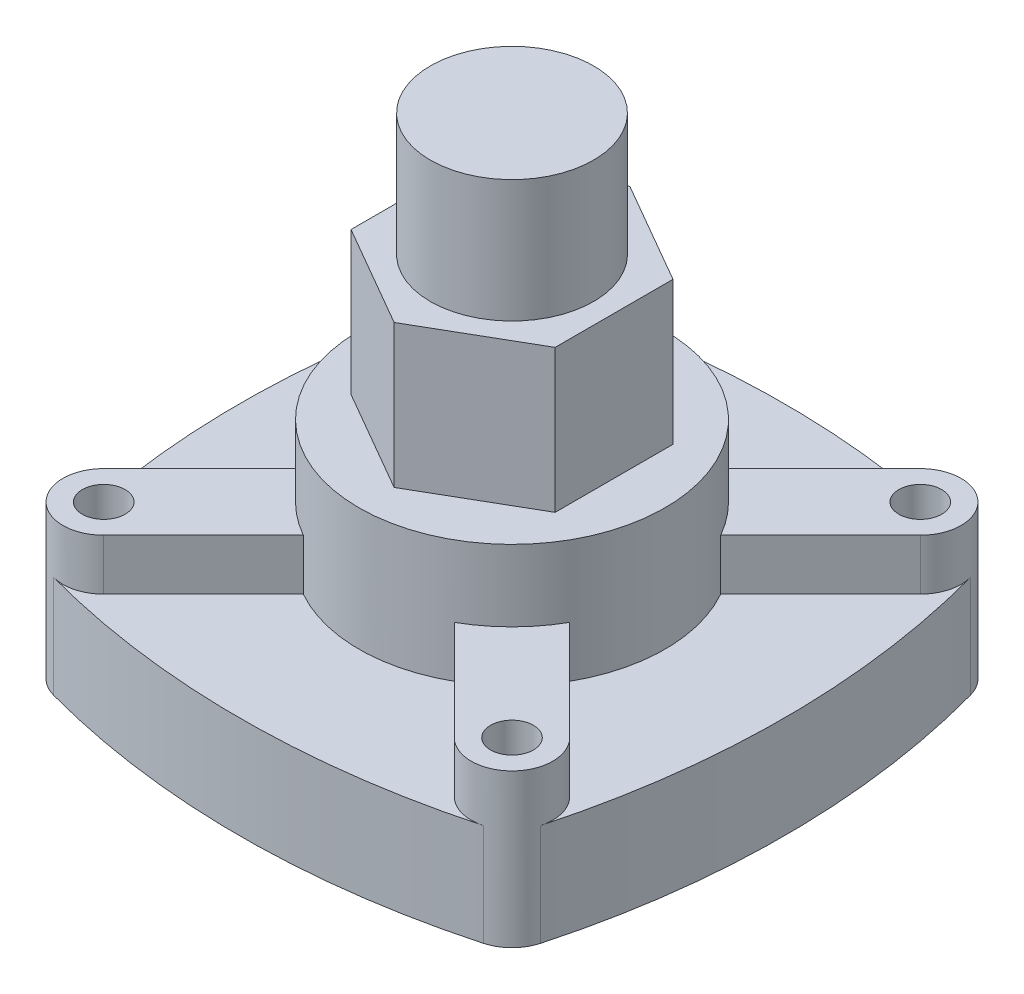
from build123d import *

# Parameters (mm, degrees)
SKETCH3_R             = 4
BOSS_EXTRUDE2_DEPTH   = 10
SKETCH4_R             = 15
BOSS_EXTRUDE3_DEPTH   = 12
SHELL2_T              = -1
BOSS_EXTRUDE4_DEPTH   = 14
SKETCH6_R             = 8
BOSS_EXTRUDE5_DEPTH   = 12
BOSS_EXTRUDE6_DEPTH   = 5
M5X0_8_TAPPED_HOLE1_D = 4.2


with BuildPart() as part:
    # Sketch3 → Boss-Extrude2 (new body)
    with BuildSketch(Plane(origin=(0, 0, 0), x_dir=(1, 0, 0), z_dir=(0, 1, 0))):
        with Locations((-20, -20)):
            Circle(SKETCH3_R)
        with BuildLine():
            ThreePointArc((23.859011112, 21.052631579), (23.964596098, 20.531015797), (24, 20))
            ThreePointArc((24, 20), (16.821122343, 17.572092085), (21.052631579, 23.859011112))
            ThreePointArc((21.052631579, 23.859011112), (0, 26.678788881), (-21.052631579, 23.859011112))
            ThreePointArc((-21.052631579, 23.859011112), (-17.572092085, 23.178877657), (-16, 20))
            ThreePointArc((-16, 20), (-20.531015797, 16.035403902), (-23.859011112, 21.052631579))
            ThreePointArc((-23.859011112, 21.052631579), (-26.678788881, 0), (-23.859011112, -21.052631579))
            ThreePointArc((-23.859011112, -21.052631579), (-20.531015797, -16.035403902), (-16, -20))
            ThreePointArc((-16, -20), (-17.572092085, -23.178877657), (-21.052631579, -23.859011112))
            ThreePointArc((-21.052631579, -23.859011112), (0, -26.678788881), (21.052631579, -23.859011112))
            ThreePointArc((21.052631579, -23.859011112), (16.821122343, -17.572092085), (24, -20))
            ThreePointArc((24, -20), (23.964596098, -20.531015797), (23.859011112, -21.052631579))
            ThreePointArc((23.859011112, -21.052631579), (26.678788881, 0), (23.859011112, 21.052631579))
        make_face()
        with Locations((-20, 20)):
            Circle(SKETCH3_R)
        with Locations((20, -20)):
            Circle(SKETCH3_R)
        with Locations((20, 20)):
            Circle(SKETCH3_R)
    extrude(amount=BOSS_EXTRUDE2_DEPTH)

    # Sketch4 → Boss-Extrude3 (add)
    with BuildSketch(Plane(origin=(0, 10, 0), x_dir=(1, 0, 0), z_dir=(0, 1, 0))):
        with Locations(Location((0, 0, 0), (0, 0, 270))):
            Circle(SKETCH4_R)
    extrude(amount=BOSS_EXTRUDE3_DEPTH)

    # Shell2
    shell2_openings = [part.faces().sort_by_distance(p)[0] for p in [
        (0, 0, 0),
    ]]
    offset(amount=SHELL2_T, openings=shell2_openings, kind=Kind.INTERSECTION)

    # Sketch5 → Boss-Extrude4 (add)
    with BuildSketch(Plane(origin=(0, 22, 0), x_dir=(1, 0, 0), z_dir=(0, 1, 0))):
        Polygon((0, 11.547005384), (-10, 5.773502692), (-10, -5.773502692), (0, -11.547005384), (10, -5.773502692), (10, 5.773502692), align=None)
    extrude(amount=BOSS_EXTRUDE4_DEPTH)

    # Sketch6 → Boss-Extrude5 (add)
    with BuildSketch(Plane(origin=(0, 36, 0), x_dir=(1, 0, 0), z_dir=(0, 1, 0))):
        with Locations(Location((0, 0, 0), (0, 0, 270))):
            Circle(SKETCH6_R)
    extrude(amount=BOSS_EXTRUDE5_DEPTH)

    # Sketch7 → Boss-Extrude6 (add)
    with BuildSketch(Plane(origin=(0, 10, 0), x_dir=(1, 0, 0), z_dir=(0, 1, 0))):
        with BuildLine():
            ThreePointArc((23.859011112, 21.052631579), (22.828427125, 22.828427125), (21.052631579, 23.859011112))
            ThreePointArc((21.052631579, 23.859011112), (18.973409384, 23.866020138), (17.171572875, 22.828427125))
            ThreePointArc((17.171572875, 22.828427125), (16.30448187, 21.530733729), (16, 20))
            Line((16, 20), (20, 20))
            Line((20, 20), (20, 16))
            ThreePointArc((20, 16), (21.530733729, 16.30448187), (22.828427125, 17.171572875))
            ThreePointArc((22.828427125, 17.171572875), (23.69551813, 18.469266271), (24, 20))
            ThreePointArc((24, 20), (23.964596098, 20.531015797), (23.859011112, 21.052631579))
        make_face()
        with BuildLine():
            Line((20, 20), (16, 20))
            ThreePointArc((16, 20), (16.30448187, 18.469266271), (17.171572875, 17.171572875))
            Line((17.171572875, 17.171572875), (20, 20))
        make_face()
        with BuildLine():
            Line((20, 16), (20, 20))
            Line((20, 20), (17.171572875, 17.171572875))
            ThreePointArc((17.171572875, 17.171572875), (18.469266271, 16.30448187), (20, 16))
        make_face()
        with BuildLine():
            Line((17.171572875, 17.171572875), (10.606601718, 10.606601718))
            ThreePointArc((10.606601718, 10.606601718), (11.937336386, 9.082951062), (13.050951275, 7.394097025))
            Line((13.050951275, 7.394097025), (20, 14.343145751))
            Line((20, 14.343145751), (20, 16))
            ThreePointArc((20, 16), (18.469266271, 16.30448187), (17.171572875, 17.171572875))
        make_face()
        with BuildLine():
            Line((16, 20), (14.343145751, 20))
            Line((14.343145751, 20), (7.394097025, 13.050951275))
            ThreePointArc((7.394097025, 13.050951275), (9.082951062, 11.937336386), (10.606601718, 10.606601718))
            Line((10.606601718, 10.606601718), (17.171572875, 17.171572875))
            ThreePointArc((17.171572875, 17.171572875), (16.30448187, 18.469266271), (16, 20))
        make_face()
        with BuildLine():
            ThreePointArc((-7.394097025, -13.050951275), (-9.082951062, -11.937336386), (-10.606601718, -10.606601718))
            Line((-10.606601718, -10.606601718), (-17.171572875, -17.171572875))
            ThreePointArc((-17.171572875, -17.171572875), (-16.30448187, -18.469266271), (-16, -20))
            Line((-16, -20), (-14.343145751, -20))
            Line((-14.343145751, -20), (-7.394097025, -13.050951275))
        make_face()
        with BuildLine():
            Line((-17.171572875, -17.171572875), (-10.606601718, -10.606601718))
            ThreePointArc((-10.606601718, -10.606601718), (-11.937336386, -9.082951062), (-13.050951275, -7.394097025))
            Line((-13.050951275, -7.394097025), (-20, -14.343145751))
            Line((-20, -14.343145751), (-20, -16))
            ThreePointArc((-20, -16), (-18.469266271, -16.30448187), (-17.171572875, -17.171572875))
        make_face()
        with BuildLine():
            ThreePointArc((-16, -20), (-16.30448187, -18.469266271), (-17.171572875, -17.171572875))
            Line((-17.171572875, -17.171572875), (-20, -20))
            Line((-20, -20), (-16, -20))
        make_face()
        with BuildLine():
            Line((-20, -20), (-17.171572875, -17.171572875))
            ThreePointArc((-17.171572875, -17.171572875), (-18.469266271, -16.30448187), (-20, -16))
            Line((-20, -16), (-20, -20))
        make_face()
        with BuildLine():
            ThreePointArc((-22.828427125, -17.171572875), (-23.866020138, -18.973409384), (-23.859011112, -21.052631579))
            ThreePointArc((-23.859011112, -21.052631579), (-22.828427125, -22.828427125), (-21.052631579, -23.859011112))
            ThreePointArc((-21.052631579, -23.859011112), (-18.973409384, -23.866020138), (-17.171572875, -22.828427125))
            ThreePointArc((-17.171572875, -22.828427125), (-16.30448187, -21.530733729), (-16, -20))
            Line((-16, -20), (-20, -20))
            Line((-20, -20), (-20, -16))
            ThreePointArc((-20, -16), (-21.530733729, -16.30448187), (-22.828427125, -17.171572875))
        make_face()
        with BuildLine():
            ThreePointArc((21.052631579, -23.859011112), (22.828427125, -22.828427125), (23.859011112, -21.052631579))
            ThreePointArc((23.859011112, -21.052631579), (23.964596098, -20.531015797), (24, -20))
            ThreePointArc((24, -20), (23.69551813, -18.469266271), (22.828427125, -17.171572875))
            ThreePointArc((22.828427125, -17.171572875), (21.530733729, -16.30448187), (20, -16))
            Line((20, -16), (20, -20))
            Line((20, -20), (16, -20))
            ThreePointArc((16, -20), (16.30448187, -21.530733729), (17.171572875, -22.828427125))
            ThreePointArc((17.171572875, -22.828427125), (18.973409384, -23.866020138), (21.052631579, -23.859011112))
        make_face()
        with BuildLine():
            Line((20, -20), (17.171572875, -17.171572875))
            ThreePointArc((17.171572875, -17.171572875), (16.30448187, -18.469266271), (16, -20))
            Line((16, -20), (20, -20))
        make_face()
        with BuildLine():
            ThreePointArc((20, -16), (18.469266271, -16.30448187), (17.171572875, -17.171572875))
            Line((17.171572875, -17.171572875), (20, -20))
            Line((20, -20), (20, -16))
        make_face()
        with BuildLine():
            ThreePointArc((13.050951275, -7.394097025), (11.937336386, -9.082951062), (10.606601718, -10.606601718))
            Line((10.606601718, -10.606601718), (17.171572875, -17.171572875))
            ThreePointArc((17.171572875, -17.171572875), (18.469266271, -16.30448187), (20, -16))
            Line((20, -16), (20, -14.343145751))
            Line((20, -14.343145751), (13.050951275, -7.394097025))
        make_face()
        with BuildLine():
            Line((17.171572875, -17.171572875), (10.606601718, -10.606601718))
            ThreePointArc((10.606601718, -10.606601718), (9.082951062, -11.937336386), (7.394097025, -13.050951275))
            Line((7.394097025, -13.050951275), (14.343145751, -20))
            Line((14.343145751, -20), (16, -20))
            ThreePointArc((16, -20), (16.30448187, -18.469266271), (17.171572875, -17.171572875))
        make_face()
        with BuildLine():
            Line((17.171572875, 22.828427125), (14.343145751, 20))
            Line((14.343145751, 20), (16, 20))
            ThreePointArc((16, 20), (16.30448187, 21.530733729), (17.171572875, 22.828427125))
        make_face()
        with BuildLine():
            ThreePointArc((22.828427125, 17.171572875), (21.530733729, 16.30448187), (20, 16))
            Line((20, 16), (20, 14.343145751))
            Line((20, 14.343145751), (22.828427125, 17.171572875))
        make_face()
        with BuildLine():
            ThreePointArc((-16, 20), (-16.30448187, 21.530733729), (-17.171572875, 22.828427125))
            ThreePointArc((-17.171572875, 22.828427125), (-18.973409384, 23.866020138), (-21.052631579, 23.859011112))
            ThreePointArc((-21.052631579, 23.859011112), (-22.828427125, 22.828427125), (-23.859011112, 21.052631579))
            ThreePointArc((-23.859011112, 21.052631579), (-23.866020138, 18.973409384), (-22.828427125, 17.171572875))
            ThreePointArc((-22.828427125, 17.171572875), (-21.530733729, 16.30448187), (-20, 16))
            Line((-20, 16), (-20, 20))
            Line((-20, 20), (-16, 20))
        make_face()
        with BuildLine():
            Line((-20, 14.343145751), (-20, 16))
            ThreePointArc((-20, 16), (-21.530733729, 16.30448187), (-22.828427125, 17.171572875))
            Line((-22.828427125, 17.171572875), (-20, 14.343145751))
        make_face()
        with BuildLine():
            Line((-17.171572875, 17.171572875), (-20, 20))
            Line((-20, 20), (-20, 16))
            ThreePointArc((-20, 16), (-18.469266271, 16.30448187), (-17.171572875, 17.171572875))
        make_face()
        with BuildLine():
            ThreePointArc((-17.171572875, 17.171572875), (-16.30448187, 18.469266271), (-16, 20))
            Line((-16, 20), (-20, 20))
            Line((-20, 20), (-17.171572875, 17.171572875))
        make_face()
        with BuildLine():
            Line((-14.343145751, 20), (-17.171572875, 22.828427125))
            ThreePointArc((-17.171572875, 22.828427125), (-16.30448187, 21.530733729), (-16, 20))
            Line((-16, 20), (-14.343145751, 20))
        make_face()
        with BuildLine():
            Line((-7.394097025, 13.050951275), (-14.343145751, 20))
            Line((-14.343145751, 20), (-16, 20))
            ThreePointArc((-16, 20), (-16.30448187, 18.469266271), (-17.171572875, 17.171572875))
            Line((-17.171572875, 17.171572875), (-10.606601718, 10.606601718))
            ThreePointArc((-10.606601718, 10.606601718), (-9.082951062, 11.937336386), (-7.394097025, 13.050951275))
        make_face()
        with BuildLine():
            Line((-10.606601718, 10.606601718), (-17.171572875, 17.171572875))
            ThreePointArc((-17.171572875, 17.171572875), (-18.469266271, 16.30448187), (-20, 16))
            Line((-20, 16), (-20, 14.343145751))
            Line((-20, 14.343145751), (-13.050951275, 7.394097025))
            ThreePointArc((-13.050951275, 7.394097025), (-11.937336386, 9.082951062), (-10.606601718, 10.606601718))
        make_face()
        with BuildLine():
            ThreePointArc((-16, -20), (-16.30448187, -21.530733729), (-17.171572875, -22.828427125))
            Line((-17.171572875, -22.828427125), (-14.343145751, -20))
            Line((-14.343145751, -20), (-16, -20))
        make_face()
        with BuildLine():
            Line((-20, -16), (-20, -14.343145751))
            Line((-20, -14.343145751), (-22.828427125, -17.171572875))
            ThreePointArc((-22.828427125, -17.171572875), (-21.530733729, -16.30448187), (-20, -16))
        make_face()
        with BuildLine():
            Line((16, -20), (14.343145751, -20))
            Line((14.343145751, -20), (17.171572875, -22.828427125))
            ThreePointArc((17.171572875, -22.828427125), (16.30448187, -21.530733729), (16, -20))
        make_face()
        with BuildLine():
            Line((22.828427125, -17.171572875), (20, -14.343145751))
            Line((20, -14.343145751), (20, -16))
            ThreePointArc((20, -16), (21.530733729, -16.30448187), (22.828427125, -17.171572875))
        make_face()
    extrude(amount=BOSS_EXTRUDE6_DEPTH)

    # M5x0.8 Tapped Hole1 (through all)
    with Locations(Plane(origin=(0, 15, 0), x_dir=(1, 0, 0), z_dir=(0, 1, 0))):
        with Locations((20, -20), (20, 20), (-20, 20), (-20, -20)):
            Hole(M5X0_8_TAPPED_HOLE1_D / 2)


solid = part.part
